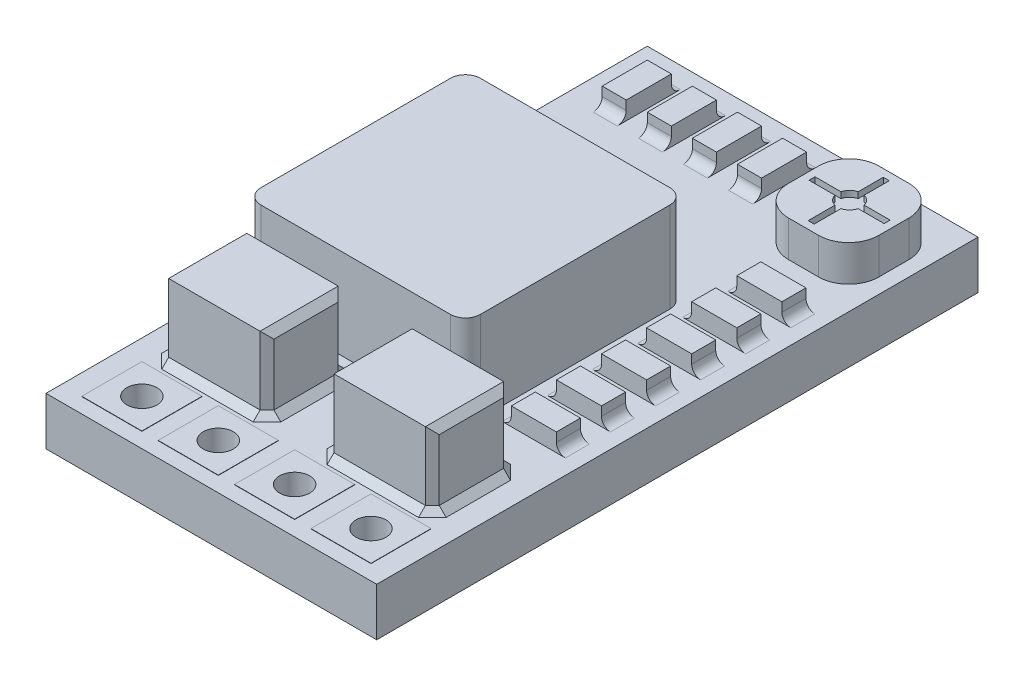
from build123d import *

# Parameters (mm, degrees)
SKETCH1_W                = 11
SKETCH1_H                = 20
BOSS_EXTRUDE1_DEPTH      = 1.6
SKETCH2_R                = 0.5
CUT_EXTRUDE1_DEPTH       = 1
BOSS_EXTRUDE2_DEPTH      = 0.01
BOSS_EXTRUDE2_DEPTH_BACK = 1.01
SKETCH3_W                = 2
SKETCH3_H                = 2
SKETCH3_R                = 0.5
SKETCH4_W                = 3.5
SKETCH4_H                = 2.6
BOSS_EXTRUDE3_DEPTH      = 2.5
CHAMFER1_SIZE            = 0.23
SKETCH5_W                = 7.3
SKETCH5_H                = 7.3
BOSS_EXTRUDE4_DEPTH      = 3
SKETCH7_W                = 0.8
SKETCH7_H                = 1.5
BOSS_EXTRUDE5_DEPTH      = 0.6
SKETCH8_W                = 3
SKETCH8_H                = 3
BOSS_EXTRUDE6_DEPTH      = 1.2
SKETCH9_W                = 0.2
SKETCH9_H                = 2.5
SKETCH9_W_2              = 2.5
SKETCH9_H_2              = 0.2
CUT_EXTRUDE4_DEPTH       = 0.2
FILLET2_R                = 1
SKETCH11_W               = 1.5
SKETCH11_H               = 0.8
BOSS_EXTRUDE7_DEPTH      = 0.6
FILLET3_R                = 0.3
SKETCH12_R               = 0.4
CUT_EXTRUDE5_DEPTH       = 0.2
SKETCH13_W               = 3
SKETCH13_H               = 1.5
BOSS_EXTRUDE8_DEPTH      = 0.5
SKETCH15_W               = 0.25
SKETCH15_H               = 0.6
BOSS_EXTRUDE9_DEPTH      = 0.2
FILLET4_R                = 0.2
FILLET_1_R               = 0.5


with BuildPart() as part:
    # Sketch1 → Boss-Extrude1 (new body)
    with BuildSketch(Plane(origin=(0, 0, 0), x_dir=(1, 0, 0), z_dir=(0, 1, 0))):
        with Locations((5.5, -10)):
            Rectangle(SKETCH1_W, SKETCH1_H)
    extrude(amount=BOSS_EXTRUDE1_DEPTH)

    # Sketch2 → Cut-Extrude1 (cut)
    with BuildSketch(Plane(origin=(0, 1.6, 0), x_dir=(1, 0, 0), z_dir=(0, 1, 0))):
        with Locations(Location((1.69, -18.5, 0), (0, 0, 270))):
            Circle(SKETCH2_R)
        with Locations(Location((4.23, -18.5, 0), (0, 0, 270))):
            Circle(SKETCH2_R)
        with Locations(Location((6.77, -18.5, 0), (0, 0, 270))):
            Circle(SKETCH2_R)
        with Locations(Location((9.31, -18.5, 0), (0, 0, 270))):
            Circle(SKETCH2_R)
    extrude(amount=-CUT_EXTRUDE1_DEPTH, mode=Mode.SUBTRACT)

    # Sketch3 → Boss-Extrude2 (add, two sides: drawn at the far end of the back side and taken through both)
    # profile 1 of 4: a face of its own
    with BuildSketch(Plane(origin=(0, 1.6, 0), x_dir=(1, 0, 0), z_dir=(0, 1, 0)).offset(-BOSS_EXTRUDE2_DEPTH_BACK)):
        with Locations((4.23, -18.5)):
            Rectangle(SKETCH3_W, SKETCH3_H)
        with Locations(Location((4.23, -18.5, 0), (0, 0, 270))):
            Circle(SKETCH3_R, mode=Mode.SUBTRACT)
    # profile 2 of 4: a face of its own
    with BuildSketch(Plane(origin=(0, 1.6, 0), x_dir=(1, 0, 0), z_dir=(0, 1, 0)).offset(-BOSS_EXTRUDE2_DEPTH_BACK)):
        with Locations((1.69, -18.5)):
            Rectangle(SKETCH3_W, SKETCH3_H)
        with Locations(Location((1.69, -18.5, 0), (0, 0, 270))):
            Circle(SKETCH3_R, mode=Mode.SUBTRACT)
    # profile 3 of 4: a face of its own
    with BuildSketch(Plane(origin=(0, 1.6, 0), x_dir=(1, 0, 0), z_dir=(0, 1, 0)).offset(-BOSS_EXTRUDE2_DEPTH_BACK)):
        with Locations((6.77, -18.5)):
            Rectangle(SKETCH3_W, SKETCH3_H)
        with Locations(Location((6.77, -18.5, 0), (0, 0, 270))):
            Circle(SKETCH3_R, mode=Mode.SUBTRACT)
    # profile 4 of 4: a face of its own
    with BuildSketch(Plane(origin=(0, 1.6, 0), x_dir=(1, 0, 0), z_dir=(0, 1, 0)).offset(-BOSS_EXTRUDE2_DEPTH_BACK)):
        with Locations((9.31, -18.5)):
            Rectangle(SKETCH3_W, SKETCH3_H)
        with Locations(Location((9.31, -18.5, 0), (0, 0, 270))):
            Circle(SKETCH3_R, mode=Mode.SUBTRACT)
    extrude(amount=BOSS_EXTRUDE2_DEPTH + BOSS_EXTRUDE2_DEPTH_BACK)

    # Sketch4 → Boss-Extrude3 (add)
    with BuildSketch(Plane(origin=(0, 1.6, 0), x_dir=(1, 0, 0), z_dir=(0, 1, 0))):
        with Locations((2.75, -15.85)):
            Rectangle(SKETCH4_W, SKETCH4_H)
        with Locations((8.25, -15.85)):
            Rectangle(SKETCH4_W, SKETCH4_H)
    extrude(amount=BOSS_EXTRUDE3_DEPTH)

    # Chamfer1
    chamfer1_edges = [part.edges().sort_by_distance(p)[0] for p in [
        (1, 1.6, 15.85),
        (1, 2.85, 14.55),
        (2.75, 1.6, 17.15),
        (1, 2.85, 17.15),
        (4.5, 1.6, 15.85),
        (4.5, 2.85, 17.15),
        (2.75, 1.6, 14.55),
        (4.5, 2.85, 14.55),
        (1, 4.1, 15.85),
        (4.5, 4.1, 15.85),
        (8.25, 1.6, 14.55),
        (10, 2.85, 14.55),
        (6.5, 1.6, 15.85),
        (6.5, 2.85, 14.55),
        (8.25, 1.6, 17.15),
        (6.5, 2.85, 17.15),
        (10, 1.6, 15.85),
        (10, 2.85, 17.15),
        (6.5, 4.1, 15.85),
        (10, 4.1, 15.85),
    ]]
    chamfer(chamfer1_edges, length=CHAMFER1_SIZE)

    # Sketch5 → Boss-Extrude4 (add)
    with BuildSketch(Plane(origin=(0, 1.6, 0), x_dir=(1, 0, 0), z_dir=(0, 1, 0))):
        with Locations((4.30013735, -10.35)):
            Rectangle(SKETCH5_W, SKETCH5_H)
    extrude(amount=BOSS_EXTRUDE4_DEPTH)

    # Sketch7 → Boss-Extrude5 (add)
    with BuildSketch(Plane(origin=(0, 1.6, 0), x_dir=(1, 0, 0), z_dir=(0, 1, 0))):
        with Locations((1.4, -1.75)):
            Rectangle(SKETCH7_W, SKETCH7_H)
        with Locations((2.9, -1.75)):
            Rectangle(SKETCH7_W, SKETCH7_H)
        with Locations((4.4, -1.75)):
            Rectangle(SKETCH7_W, SKETCH7_H)
        with Locations((5.9, -1.75)):
            Rectangle(SKETCH7_W, SKETCH7_H)
    extrude(amount=BOSS_EXTRUDE5_DEPTH)

    # Sketch8 → Boss-Extrude6 (add)
    with BuildSketch(Plane(origin=(0, 1.6, 0), x_dir=(1, 0, 0), z_dir=(0, 1, 0))):
        with Locations((9, -2.3)):
            Rectangle(SKETCH8_W, SKETCH8_H)
    extrude(amount=BOSS_EXTRUDE6_DEPTH)

    # Sketch9 → Cut-Extrude4 (cut)
    with BuildSketch(Plane(origin=(0, 2.8, 0), x_dir=(1, 0, 0), z_dir=(0, 1, 0))):
        with Locations((9, -2.3)):
            Rectangle(SKETCH9_W, SKETCH9_H)
        with Locations((9, -2.271805508)):
            Rectangle(SKETCH9_W_2, SKETCH9_H_2)
    extrude(amount=-CUT_EXTRUDE4_DEPTH, mode=Mode.SUBTRACT)

    # Fillet2
    fillet2_edges = [part.edges().sort_by_distance(p)[0] for p in [
        (7.5, 2.2, 0.8),
        (7.5, 2.2, 3.8),
        (10.5, 2.2, 3.8),
        (10.5, 2.2, 0.8),
    ]]
    fillet(fillet2_edges, radius=FILLET2_R)

    # Sketch11 → Boss-Extrude7 (add)
    with BuildSketch(Plane(origin=(0, 1.6, 0), x_dir=(1, 0, 0), z_dir=(0, 1, 0))):
        with Locations((9.45, -5.323632775)):
            Rectangle(SKETCH11_W, SKETCH11_H)
        with Locations((9.45, -6.823632775)):
            Rectangle(SKETCH11_W, SKETCH11_H)
        with Locations((9.45, -8.323632775)):
            Rectangle(SKETCH11_W, SKETCH11_H)
        with Locations((9.45, -9.823632775)):
            Rectangle(SKETCH11_W, SKETCH11_H)
        with Locations((9.45, -11.323632775)):
            Rectangle(SKETCH11_W, SKETCH11_H)
        with Locations((9.45, -12.823632775)):
            Rectangle(SKETCH11_W, SKETCH11_H)
    extrude(amount=BOSS_EXTRUDE7_DEPTH)

    # Fillet3
    fillet3_edges = [part.edges().sort_by_distance(p)[0] for p in [
        (1.4, 1.6, 2.5),
        (1.4, 1.6, 1),
        (2.9, 1.6, 2.5),
        (2.9, 1.6, 1),
        (4.4, 1.6, 2.5),
        (4.4, 1.6, 1),
        (5.9, 1.6, 2.5),
        (5.9, 1.6, 1),
        (8.7, 1.6, 5.323632775),
        (10.2, 1.6, 5.323632775),
        (8.7, 1.6, 6.823632775),
        (10.2, 1.6, 6.823632775),
        (8.7, 1.6, 8.323632775),
        (10.2, 1.6, 8.323632775),
        (8.7, 1.6, 9.823632775),
        (10.2, 1.6, 9.823632775),
        (8.7, 1.6, 11.323632775),
        (10.2, 1.6, 11.323632775),
        (8.7, 1.6, 12.823632775),
        (10.2, 1.6, 12.823632775),
    ]]
    fillet(fillet3_edges, radius=FILLET3_R)

    # Sketch12 → Cut-Extrude5 (cut)
    with BuildSketch(Plane(origin=(0, 2.8, 0), x_dir=(1, 0, 0), z_dir=(0, 1, 0))):
        with Locations((9, -2.271805508)):
            Circle(SKETCH12_R)
    extrude(amount=-CUT_EXTRUDE5_DEPTH, mode=Mode.SUBTRACT)

    # Sketch13 → Boss-Extrude8 (add)
    with BuildSketch(Plane(origin=(0, 1.6, 0), x_dir=(1, 0, 0), z_dir=(0, 1, 0))):
        with Locations((3.189393632, -5.25)):
            Rectangle(SKETCH13_W, SKETCH13_H)
    extrude(amount=BOSS_EXTRUDE8_DEPTH)

    # Sketch15 → Boss-Extrude9 (add)
    with BuildSketch(Plane(origin=(0, 1.6, 0), x_dir=(1, 0, 0), z_dir=(0, 1, 0))):
        with Locations((1.814393632, -4.2)):
            Rectangle(SKETCH15_W, SKETCH15_H)
        with Locations((2.724393632, -4.2)):
            Rectangle(SKETCH15_W, SKETCH15_H)
        with Locations((3.634393632, -4.2)):
            Rectangle(SKETCH15_W, SKETCH15_H)
        with Locations((4.544393632, -4.2)):
            Rectangle(SKETCH15_W, SKETCH15_H)
        with Locations((4.544393632, -6.3)):
            Rectangle(SKETCH15_W, SKETCH15_H)
        with Locations((3.634393632, -6.3)):
            Rectangle(SKETCH15_W, SKETCH15_H)
        with Locations((2.724393632, -6.3)):
            Rectangle(SKETCH15_W, SKETCH15_H)
        with Locations((1.814393632, -6.3)):
            Rectangle(SKETCH15_W, SKETCH15_H)
    extrude(amount=BOSS_EXTRUDE9_DEPTH)

    # Fillet4
    fillet4_edges = [part.edges().sort_by_distance(p)[0] for p in [
        (1.814393632, 1.8, 4.5),
        (2.724393632, 1.8, 4.5),
        (3.634393632, 1.8, 4.5),
        (4.544393632, 1.8, 4.5),
        (4.544393632, 1.8, 6),
        (3.634393632, 1.8, 6),
        (2.724393632, 1.8, 6),
        (1.814393632, 1.8, 6),
    ]]
    fillet(fillet4_edges, radius=FILLET4_R)

    # Скругление1
    fillet_1_edges = [part.edges().sort_by_distance(p)[0] for p in [
        (0.65013735, 3.1, 6.7),
        (0.65013735, 3.1, 14),
        (7.95013735, 3.1, 14),
        (7.95013735, 3.1, 6.7),
    ]]
    fillet(fillet_1_edges, radius=FILLET_1_R)


solid = part.part
